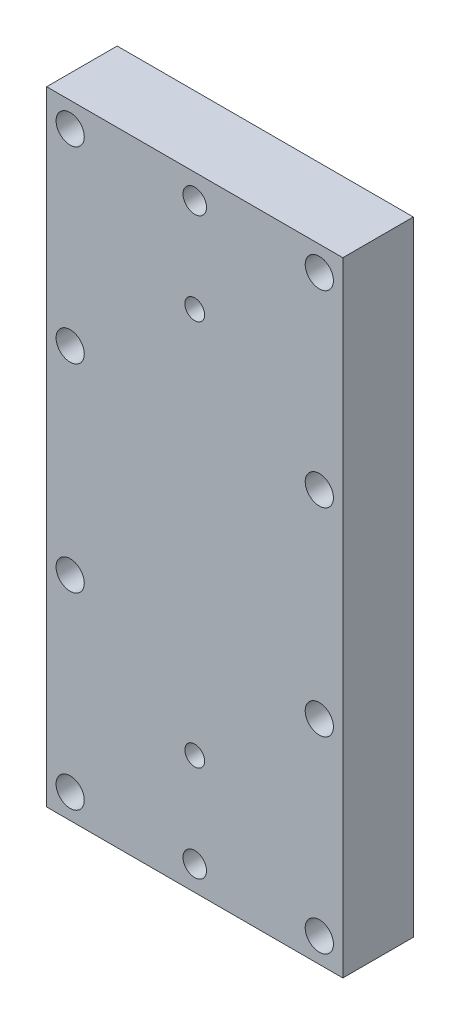
from build123d import *

# Parameters (mm, degrees)
SKETCH1_W           = 63
SKETCH1_H           = 132.7
SKETCH1_R           = 3
BOSS_EXTRUDE1_DEPTH = 15
SETSCREWS_D         = 4.2
SCREWHOLES_D        = 5


with BuildPart() as part:
    # Sketch1 → Boss-Extrude1 (new body)
    with BuildSketch(Plane.XY):
        with Locations((0, 41.1)):
            Rectangle(SKETCH1_W, SKETCH1_H)
        with Locations((-26.5, 20)):
            Circle(SKETCH1_R, mode=Mode.SUBTRACT)
        with Locations((-26.5, -20)):
            Circle(SKETCH1_R, mode=Mode.SUBTRACT)
        with Locations((26.5, -20)):
            Circle(SKETCH1_R, mode=Mode.SUBTRACT)
        with Locations((26.5, 20)):
            Circle(SKETCH1_R, mode=Mode.SUBTRACT)
        with Locations((-26.5, 102.2)):
            Circle(SKETCH1_R, mode=Mode.SUBTRACT)
        with Locations((-26.5, 62.2)):
            Circle(SKETCH1_R, mode=Mode.SUBTRACT)
        with Locations((26.5, 62.2)):
            Circle(SKETCH1_R, mode=Mode.SUBTRACT)
        with Locations((26.5, 102.2)):
            Circle(SKETCH1_R, mode=Mode.SUBTRACT)
    extrude(amount=BOSS_EXTRUDE1_DEPTH)

    # setscrews (through all)
    with Locations(Plane(origin=(0, 82.2, 15), x_dir=(1, 0, 0), z_dir=(0, 0, 1))):
        with Locations((0, 0), (0, -82.2)):
            Hole(SETSCREWS_D / 2)

    # screwHoles (through all)
    with Locations(Plane(origin=(0, 102.2, 15), x_dir=(1, 0, 0), z_dir=(0, 0, 1))):
        with Locations((0, 0), (0, -122.2)):
            Hole(SCREWHOLES_D / 2)


solid = part.part
